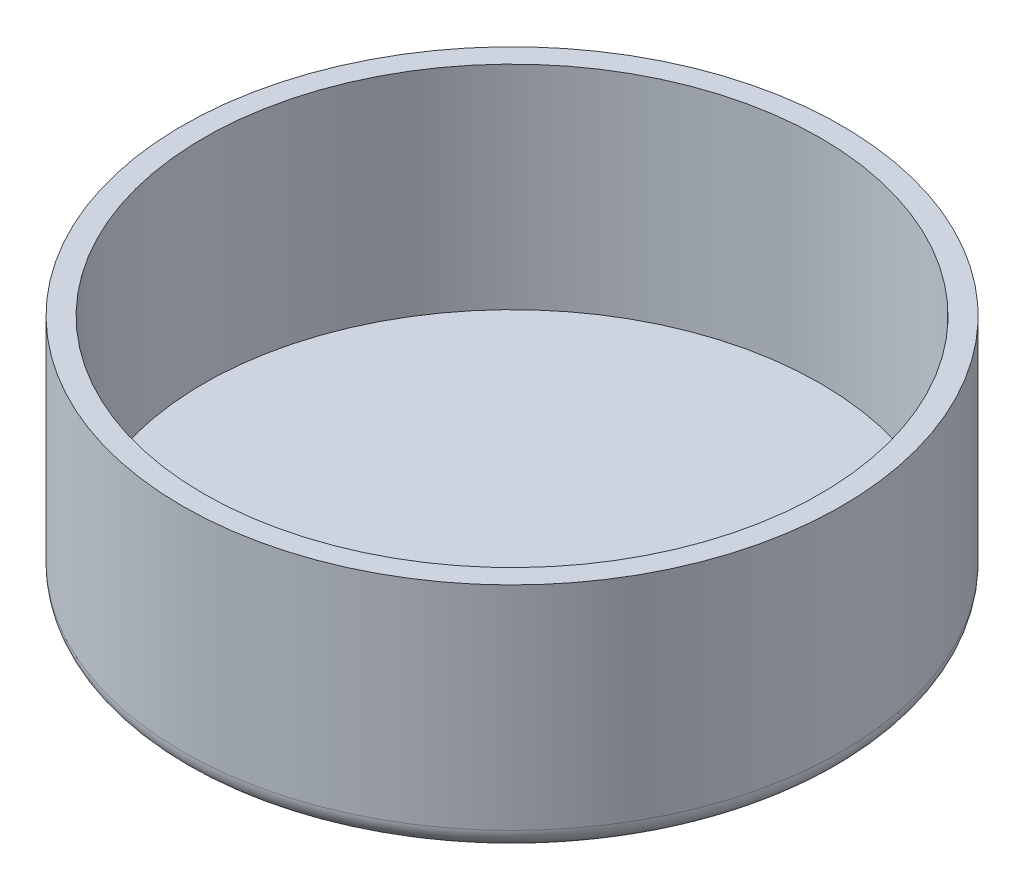
from build123d import *

# Parameters (mm, degrees)
SKETCH1_R           = 15.5
BOSS_EXTRUDE1_DEPTH = 1
SKETCH3_R           = 15.5
SKETCH3_R_2         = 14.5
BOSS_EXTRUDE2_DEPTH = 10
FILLET1_R           = 1


with BuildPart() as part:
    # Sketch1 → Boss-Extrude1 (new body)
    with BuildSketch(Plane(origin=(0, 0, 0), x_dir=(1, 0, 0), z_dir=(0, 1, 0))):
        with Locations(Location((0, 0, 0), (0, 0, 270))):
            Circle(SKETCH1_R)
    extrude(amount=BOSS_EXTRUDE1_DEPTH)

    # Sketch3 → Boss-Extrude2 (add)
    with BuildSketch(Plane(origin=(0, 1, 0), x_dir=(1, 0, 0), z_dir=(0, 1, 0))):
        with Locations(Location((0, 0, 0), (0, 0, 270))):
            Circle(SKETCH3_R)
        with Locations(Location((0, 0, 0), (0, 0, 270))):
            Circle(SKETCH3_R_2, mode=Mode.SUBTRACT)
    extrude(amount=BOSS_EXTRUDE2_DEPTH)

    # Fillet1
    fillet1_edges = [part.edges().sort_by_distance(p)[0] for p in [
        (0, 0, -15.5),
    ]]
    fillet(fillet1_edges, radius=FILLET1_R)


solid = part.part
